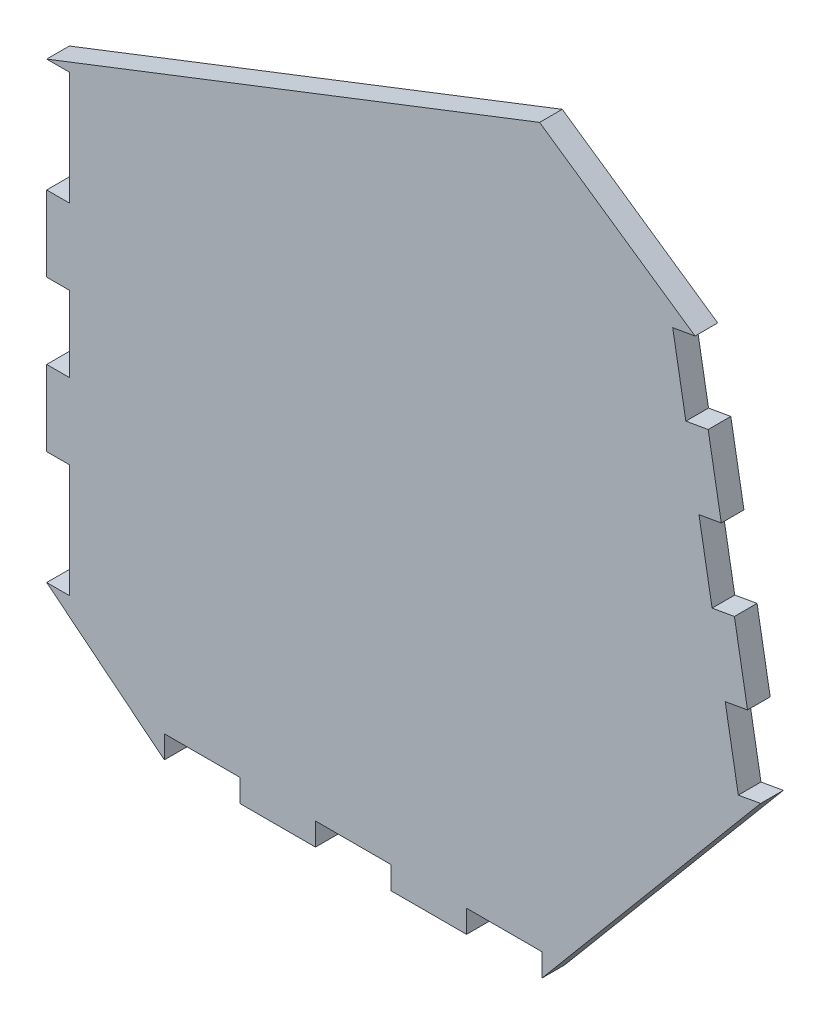
from build123d import *

# Parameters (mm, degrees)
BOSS_EXTRUDE2_DEPTH = 3


with BuildPart() as part:
    # Sketch1 → Boss-Extrude2 (new body)
    with BuildSketch(Plane.XY):
        Polygon((-28.809910954, -18.295958876), (-31.809910954, -18.295958876), (-16.234936413, -30.842678291), (-16.234936413, -27.842678291), (-6.234936413, -27.842678291), (-6.234936413, -30.842678291), (3.765063587, -30.842678291), (3.765063587, -27.842678291), (13.765063587, -27.842678291), (13.765063587, -30.842678291), (23.765063587, -30.842678291), (23.765063587, -27.842678291), (33.765063587, -27.842678291), (33.765063587, -30.842678291), (62.690506023, 3.62932165), (59.736082763, 3.108377117), (57.999600987, 12.956454647), (60.954024246, 13.47739918), (59.217542469, 23.32547671), (56.26311921, 22.804532177), (54.526637433, 32.652609707), (57.481060693, 33.17355424), (55.744578916, 43.02163177), (52.790155657, 42.500687237), (51.05367388, 52.348764767), (54.008097139, 52.8697093), (33.432510355, 67.069893401), (-31.809910954, 41.704041124), (-28.809910954, 41.704041124), (-28.809910954, 26.704041124), (-31.809910954, 26.704041124), (-31.809910954, 16.704041124), (-28.809910954, 16.704041124), (-28.809910954, 6.704041124), (-31.809910954, 6.704041124), (-31.809910954, -3.295958876), (-28.809910954, -3.295958876), align=None)
    extrude(amount=BOSS_EXTRUDE2_DEPTH)


solid = part.part
